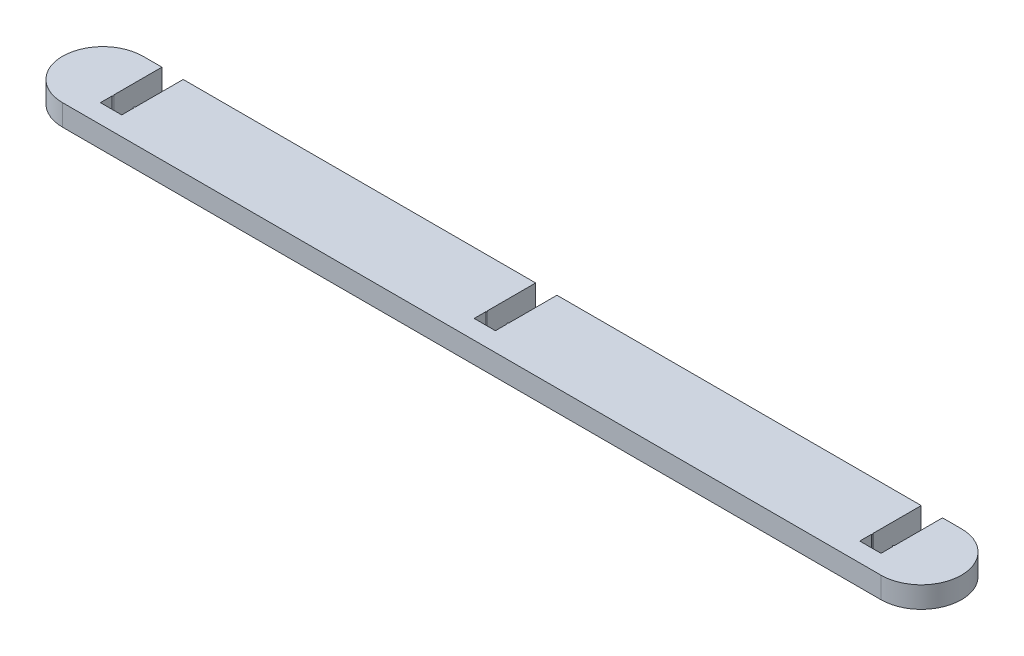
from build123d import *

# Parameters (mm, degrees)
BOSS_EXTRUDE1_DEPTH = 4.5


with BuildPart() as part:
    # Sketch1 → Boss-Extrude1 (new body)
    with BuildSketch(Plane(origin=(0, 0, 0), x_dir=(1, 0, 0), z_dir=(0, 1, 0))):
        with BuildLine():
            Line((40.921196651, 2.452604877), (83.421196651, 2.452604877))
            Line((83.421196651, 2.452604877), (87.921196651, 2.452604877))
            Line((87.921196651, 2.452604877), (117.921196651, 2.452604877))
            Line((117.921196651, 2.452604877), (117.921196651, -7.751372429))
            ThreePointArc((117.921196651, -7.751372429), (118.069207998, -7.899383776), (117.921196651, -8.047395123))
            Line((117.921196651, -8.047395123), (117.921196651, -10.547395123))
            Line((117.921196651, -10.547395123), (122.421196651, -10.547395123))
            Line((122.421196651, -10.547395123), (122.421196651, -8.047395123))
            ThreePointArc((122.421196651, -8.047395123), (122.268740731, -7.894939202), (122.421196651, -7.742483282))
            Line((122.421196651, -7.742483282), (122.421196651, 2.452604877))
            Line((122.421196651, 2.452604877), (126.421196651, 2.452604877))
            ThreePointArc((126.421196651, 2.452604877), (134.921196651, -6.047395123), (126.421196651, -14.547395123))
            Line((126.421196651, -14.547395123), (-46.578803349, -14.547395123))
            ThreePointArc((-46.578803349, -14.547395123), (-55.078803349, -6.047395123), (-46.578803349, 2.452604877))
            Line((-46.578803349, 2.452604877), (-42.578803349, 2.452604877))
            Line((-42.578803349, 2.452604877), (-42.578803349, -7.749399248))
            ThreePointArc((-42.578803349, -7.749399248), (-42.429805412, -7.898397185), (-42.578803349, -8.047395123))
            Line((-42.578803349, -8.047395123), (-42.578803349, -10.547395123))
            Line((-42.578803349, -10.547395123), (-38.078803349, -10.547395123))
            Line((-38.078803349, -10.547395123), (-38.078803349, -8.047395123))
            ThreePointArc((-38.078803349, -8.047395123), (-38.227801286, -7.898397185), (-38.078803349, -7.749399248))
            Line((-38.078803349, -7.749399248), (-38.078803349, 2.452604877))
            Line((-38.078803349, 2.452604877), (-8.078803349, 2.452604877))
            Line((-8.078803349, 2.452604877), (-3.578803349, 2.452604877))
            Line((-3.578803349, 2.452604877), (36.421196651, 2.452604877))
            Line((36.421196651, 2.452604877), (36.421196651, -7.747669694))
            ThreePointArc((36.421196651, -7.747669694), (36.571059365, -7.897532409), (36.421196651, -8.047395123))
            Line((36.421196651, -8.047395123), (36.421196651, -10.547395123))
            Line((36.421196651, -10.547395123), (40.921196651, -10.547395123))
            Line((40.921196651, -10.547395123), (40.921196651, -8.047395123))
            ThreePointArc((40.921196651, -8.047395123), (40.771333937, -7.897532409), (40.921196651, -7.747669694))
            Line((40.921196651, -7.747669694), (40.921196651, 2.452604877))
        make_face()
    extrude(amount=BOSS_EXTRUDE1_DEPTH)


solid = part.part
